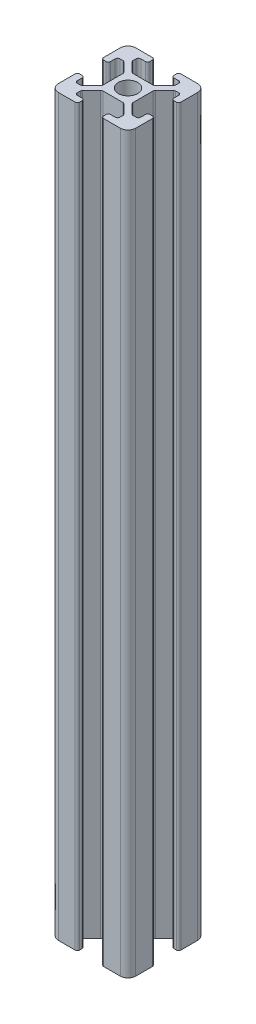
from build123d import *

# Parameters (mm, degrees)
SKETCH_1_R      = 2.5
EXTRUDE_1_DEPTH = 190


with BuildPart() as part:
    # 草图1 → 凸台-拉伸1 (new body)
    with BuildSketch(Plane(origin=(0, 0, 0), x_dir=(1, 0, 0), z_dir=(0, 1, 0))):
        with BuildLine():
            Line((3.1, 8.8), (3.1, 9.4))
            ThreePointArc((3.1, 9.4), (3.275735931, 9.824264069), (3.7, 10))
            Line((3.7, 10), (8, 10))
            ThreePointArc((8, 10), (9.414213562, 9.414213562), (10, 8))
            Line((10, 8), (10, 3.7))
            ThreePointArc((10, 3.7), (9.824264069, 3.275735931), (9.4, 3.1))
            Line((9.4, 3.1), (8.8, 3.1))
            ThreePointArc((8.8, 3.1), (8.375735931, 3.275735931), (8.2, 3.7))
            Line((8.2, 3.7), (8.2, 4.9))
            ThreePointArc((8.2, 4.9), (8.024264069, 5.324264069), (7.6, 5.5))
            Line((7.6, 5.5), (6.809188309, 5.5))
            ThreePointArc((6.809188309, 5.5), (6.57957825, 5.45432772), (6.38492424, 5.324264069))
            Line((6.38492424, 5.324264069), (4.075735931, 3.01507576))
            ThreePointArc((4.075735931, 3.01507576), (3.94567228, 2.82042175), (3.9, 2.590811691))
            Line((3.9, 2.590811691), (3.9, 0))
            Line((3.9, 0), (3.9, -2.590811691))
            ThreePointArc((3.9, -2.590811691), (3.94567228, -2.82042175), (4.075735931, -3.01507576))
            Line((4.075735931, -3.01507576), (6.38492424, -5.324264069))
            ThreePointArc((6.38492424, -5.324264069), (6.57957825, -5.45432772), (6.809188309, -5.5))
            Line((6.809188309, -5.5), (7.6, -5.5))
            ThreePointArc((7.6, -5.5), (8.024264069, -5.324264069), (8.2, -4.9))
            Line((8.2, -4.9), (8.2, -3.7))
            ThreePointArc((8.2, -3.7), (8.375735931, -3.275735931), (8.8, -3.1))
            Line((8.8, -3.1), (9.4, -3.1))
            ThreePointArc((9.4, -3.1), (9.824264069, -3.275735931), (10, -3.7))
            Line((10, -3.7), (10, -8))
            ThreePointArc((10, -8), (9.414213562, -9.414213562), (8, -10))
            Line((8, -10), (3.7, -10))
            ThreePointArc((3.7, -10), (3.275735931, -9.824264069), (3.1, -9.4))
            Line((3.1, -9.4), (3.1, -8.8))
            ThreePointArc((3.1, -8.8), (3.275735931, -8.375735931), (3.7, -8.2))
            Line((3.7, -8.2), (4.9, -8.2))
            ThreePointArc((4.9, -8.2), (5.324264069, -8.024264069), (5.5, -7.6))
            Line((5.5, -7.6), (5.5, -6.809188309))
            ThreePointArc((5.5, -6.809188309), (5.45432772, -6.57957825), (5.324264069, -6.38492424))
            Line((5.324264069, -6.38492424), (3.01507576, -4.075735931))
            ThreePointArc((3.01507576, -4.075735931), (2.82042175, -3.94567228), (2.590811691, -3.9))
            Line((2.590811691, -3.9), (0, -3.9))
            Line((0, -3.9), (-2.590811691, -3.9))
            ThreePointArc((-2.590811691, -3.9), (-2.82042175, -3.94567228), (-3.01507576, -4.075735931))
            Line((-3.01507576, -4.075735931), (-5.324264069, -6.38492424))
            ThreePointArc((-5.324264069, -6.38492424), (-5.45432772, -6.57957825), (-5.5, -6.809188309))
            Line((-5.5, -6.809188309), (-5.5, -7.6))
            ThreePointArc((-5.5, -7.6), (-5.324264069, -8.024264069), (-4.9, -8.2))
            Line((-4.9, -8.2), (-3.7, -8.2))
            ThreePointArc((-3.7, -8.2), (-3.275735931, -8.375735931), (-3.1, -8.8))
            Line((-3.1, -8.8), (-3.1, -9.4))
            ThreePointArc((-3.1, -9.4), (-3.275735931, -9.824264069), (-3.7, -10))
            Line((-3.7, -10), (-8, -10))
            ThreePointArc((-8, -10), (-9.414213562, -9.414213562), (-10, -8))
            Line((-10, -8), (-10, -3.7))
            ThreePointArc((-10, -3.7), (-9.824264069, -3.275735931), (-9.4, -3.1))
            Line((-9.4, -3.1), (-8.8, -3.1))
            ThreePointArc((-8.8, -3.1), (-8.375735931, -3.275735931), (-8.2, -3.7))
            Line((-8.2, -3.7), (-8.2, -4.9))
            ThreePointArc((-8.2, -4.9), (-8.024264069, -5.324264069), (-7.6, -5.5))
            Line((-7.6, -5.5), (-6.809188309, -5.5))
            ThreePointArc((-6.809188309, -5.5), (-6.57957825, -5.45432772), (-6.38492424, -5.324264069))
            Line((-6.38492424, -5.324264069), (-4.075735931, -3.01507576))
            ThreePointArc((-4.075735931, -3.01507576), (-3.94567228, -2.82042175), (-3.9, -2.590811691))
            Line((-3.9, -2.590811691), (-3.9, 0))
            Line((-3.9, 0), (-3.9, 2.590811691))
            ThreePointArc((-3.9, 2.590811691), (-3.94567228, 2.82042175), (-4.075735931, 3.01507576))
            Line((-4.075735931, 3.01507576), (-6.38492424, 5.324264069))
            ThreePointArc((-6.38492424, 5.324264069), (-6.57957825, 5.45432772), (-6.809188309, 5.5))
            Line((-6.809188309, 5.5), (-7.6, 5.5))
            ThreePointArc((-7.6, 5.5), (-8.024264069, 5.324264069), (-8.2, 4.9))
            Line((-8.2, 4.9), (-8.2, 3.7))
            ThreePointArc((-8.2, 3.7), (-8.375735931, 3.275735931), (-8.8, 3.1))
            Line((-8.8, 3.1), (-9.4, 3.1))
            ThreePointArc((-9.4, 3.1), (-9.824264069, 3.275735931), (-10, 3.7))
            Line((-10, 3.7), (-10, 8))
            ThreePointArc((-10, 8), (-9.414213562, 9.414213562), (-8, 10))
            Line((-8, 10), (-3.7, 10))
            ThreePointArc((-3.7, 10), (-3.275735931, 9.824264069), (-3.1, 9.4))
            Line((-3.1, 9.4), (-3.1, 8.8))
            ThreePointArc((-3.1, 8.8), (-3.275735931, 8.375735931), (-3.7, 8.2))
            Line((-3.7, 8.2), (-4.9, 8.2))
            ThreePointArc((-4.9, 8.2), (-5.324264069, 8.024264069), (-5.5, 7.6))
            Line((-5.5, 7.6), (-5.5, 6.809188309))
            ThreePointArc((-5.5, 6.809188309), (-5.45432772, 6.57957825), (-5.324264069, 6.38492424))
            Line((-5.324264069, 6.38492424), (-3.01507576, 4.075735931))
            ThreePointArc((-3.01507576, 4.075735931), (-2.82042175, 3.94567228), (-2.590811691, 3.9))
            Line((-2.590811691, 3.9), (0, 3.9))
            Line((0, 3.9), (2.590811691, 3.9))
            ThreePointArc((2.590811691, 3.9), (2.82042175, 3.94567228), (3.01507576, 4.075735931))
            Line((3.01507576, 4.075735931), (5.324264069, 6.38492424))
            ThreePointArc((5.324264069, 6.38492424), (5.45432772, 6.57957825), (5.5, 6.809188309))
            Line((5.5, 6.809188309), (5.5, 7.6))
            ThreePointArc((5.5, 7.6), (5.324264069, 8.024264069), (4.9, 8.2))
            Line((4.9, 8.2), (3.7, 8.2))
            ThreePointArc((3.7, 8.2), (3.275735931, 8.375735931), (3.1, 8.8))
        make_face()
        with Locations(Location((0, 0, 0), (0, 0, 270))):
            Circle(SKETCH_1_R, mode=Mode.SUBTRACT)
    extrude(amount=EXTRUDE_1_DEPTH)


solid = part.part
